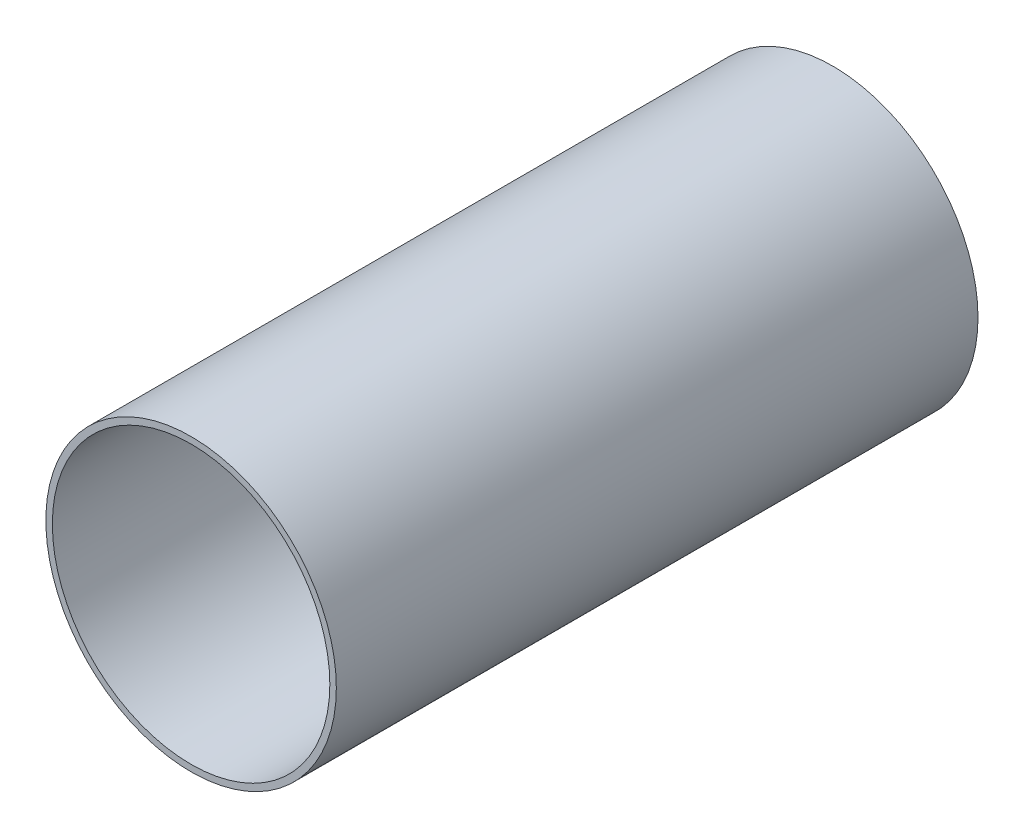
from build123d import *

# Parameters (mm, degrees)
SKETCH1_R           = 53.18125
SKETCH1_R_2         = 50.8
BOSS_EXTRUDE1_DEPTH = 234.95


with BuildPart() as part:
    # Sketch1 → Boss-Extrude1 (new body)
    with BuildSketch(Plane.XY):
        Circle(SKETCH1_R)
        Circle(SKETCH1_R_2, mode=Mode.SUBTRACT)
    extrude(amount=BOSS_EXTRUDE1_DEPTH)


solid = part.part
